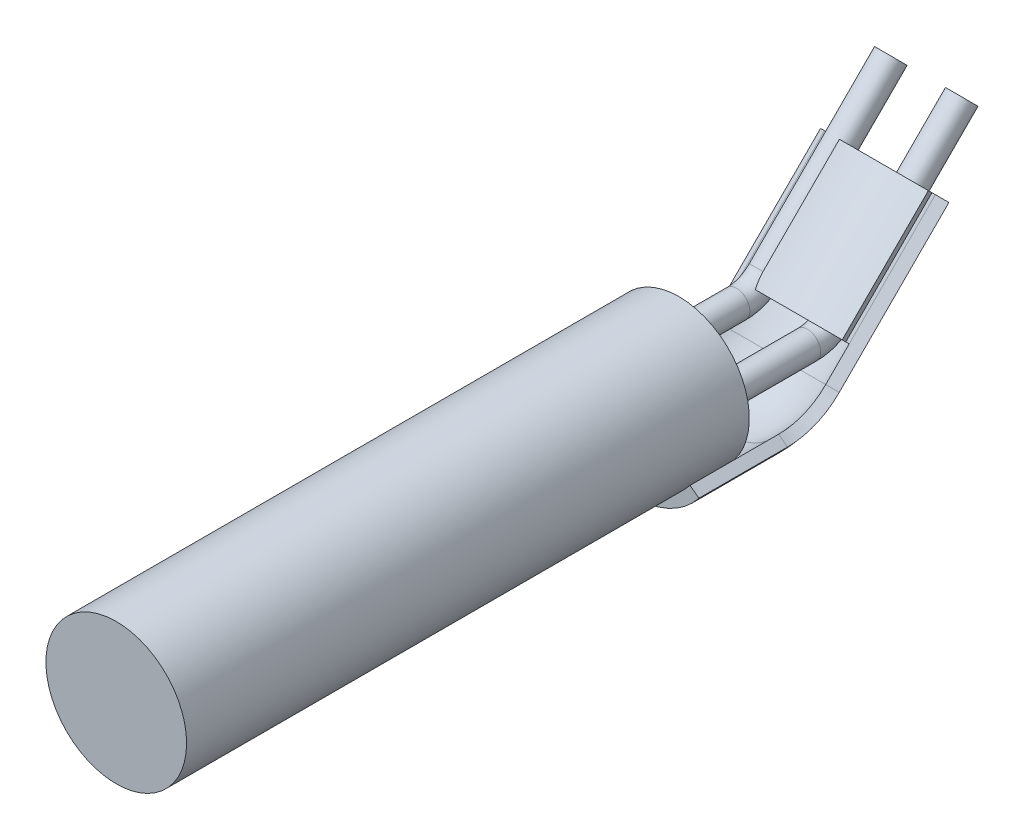
from build123d import *

# Parameters (mm, degrees)
SKETCH1_R           = 3.175
BOSS_EXTRUDE1_DEPTH = 25.4
SKETCH2_R           = 0.6
BOSS_EXTRUDE2_DEPTH = 0.5
BOSS_EXTRUDE4_DEPTH = 2
SKETCH6_R           = 0.6
BOSS_EXTRUDE5_DEPTH = 5.5


with BuildPart() as part:
    # Sketch1 → Boss-Extrude1 (new body)
    with BuildSketch(Plane.XY):
        Circle(SKETCH1_R)
    extrude(amount=BOSS_EXTRUDE1_DEPTH)

    # Sketch2 → Boss-Extrude2 (add)
    with BuildSketch(Plane(origin=(0, 0, 0), x_dir=(-1, 0, 0), z_dir=(0, 0, -1))):
        with Locations(Location((-1.6, 0, 0), (0, 0, 180))):
            Circle(SKETCH2_R)
        with Locations(Location((1.6, 0, 0), (0, 0, 180))):
            Circle(SKETCH2_R)
    extrude(amount=BOSS_EXTRUDE2_DEPTH)

    # Sketch3 → Boss-Extrude4 (add)
    with BuildSketch(Plane(origin=(0, 0, 0), x_dir=(-1, 0, 0), z_dir=(0, 0, -1))):
        with BuildLine():
            Line((-2.502919708029198, -1.9534630621434939), (-2.897080291970804, -2.2610950404338075))
            ThreePointArc((-2.897080291970804, -2.2610950404338075), (2.3e-16, -3.675), (2.897080291970804, -2.2610950404338075))
            Line((2.897080291970804, -2.2610950404338075), (2.502919708029198, -1.9534630621434939))
            ThreePointArc((2.502919708029198, -1.9534630621434939), (1.9e-16, -3.1750000000000003), (-2.502919708029198, -1.9534630621434939))
        make_face()
    extrude(amount=-BOSS_EXTRUDE4_DEPTH)

    # Sweep2: sweep along a path in Sketch4
    with BuildLine(Plane(origin=(0, 0, 0), x_dir=(0, 0, -1), z_dir=(1, 0, 0))) as sweep2_path:
        Line((0, -1.9534630621434934), (2, -1.9534630621434934))
        ThreePointArc((2, -1.9534630621434934), (3.148050297095272, -1.7251016596773525), (4.121320343559646, -1.0747834057031318))
        Line((4.121320343559646, -1.0747834057031318), (9.07106781186547, 3.874964062602709))
    # Sketch5 → Sweep2 (sweep)
    with BuildSketch(Plane(origin=(0, 0, 0), x_dir=(-1, 0, 0), z_dir=(0, 0, -1))):
        with BuildLine():
            Line((-2.897080291970804, -2.2610950404338075), (-2.502919708029198, -1.9534630621434939))
            ThreePointArc((-2.502919708029198, -1.9534630621434939), (1.9e-16, -3.1750000000000003), (2.5029197080291974, -1.9534630621434934))
            Line((2.5029197080291974, -1.9534630621434934), (2.8970802919708016, -2.2610950404338097))
            ThreePointArc((2.8970802919708016, -2.2610950404338097), (-1.41e-15, -3.675), (-2.897080291970804, -2.2610950404338075))
        make_face()
    sweep(path=sweep2_path.line)

    # Sweep3: sweep along a path in Sketch7
    with BuildLine(Plane(origin=(0, 0, 0), x_dir=(0, 0, -1), z_dir=(1, 0, 0))) as sweep3_path:
        Line((0.5, 0.6), (4.2, 0.5999999999999999))
        ThreePointArc((4.2, 0.5999999999999999), (4.678354290456363, 0.6951505843608916), (5.0838834764831855, 0.9661165235168158))
        Line((5.0838834764831855, 0.9661165235168158), (10.740737725975565, 6.622970773009196))
    # Sketch6 → Sweep3 (sweep)
    with BuildSketch(Plane(origin=(0, 0, -0.5), x_dir=(-1, 0, 0), z_dir=(0, 0, -1))):
        with Locations((-1.6, 0)):
            Circle(SKETCH6_R)
        with Locations((1.6, 0)):
            Circle(SKETCH6_R)
    sweep(path=sweep3_path.line)

    # Sketch8 → Boss-Extrude5 (add)
    with BuildSketch(Plane(origin=(0, 6.473015937234097, -6.47301593723408), x_dir=(1, 0, 0), z_dir=(0, 0.7071067811865485, -0.7071067811865467))):
        with BuildLine():
            Line((2.781137003316645, 2.8354640414089487), (2.6106804021308987, 3.3055114295648695))
            ThreePointArc((2.6106804021308987, 3.3055114295648695), (0.1288066097198567, 3.063491430701676), (-2.1639407722715798, 4.044093614911934))
            ThreePointArc((-2.1639407722715798, 4.044093614911934), (-8.516980769567e-05, 4.8957371335667155), (2.1638161204489066, 4.044209707580419))
            ThreePointArc((2.1638161204489066, 4.044209707580419), (0.35791458416402, 3.5799036404383577), (-1.2435474597789522, 4.534984686502535))
            Line((-1.2435474597789522, 4.534984686502535), (-1.645091004765738, 4.237053853120953))
            ThreePointArc((-1.645091004765738, 4.237053853120953), (0.3103286217046571, 3.0816967011024317), (2.502919708029198, 3.6742001968525564))
            Line((2.502919708029198, 3.6742001968525564), (2.897080291970804, 3.9818321751428702))
            ThreePointArc((2.897080291970804, 3.9818321751428702), (1.86e-15, 5.395737134709063), (-2.897080291970801, 3.9818321751428734))
            Line((-2.897080291970801, 3.9818321751428734), (-2.5029197080291965, 3.6742001968525577))
            ThreePointArc((-2.5029197080291965, 3.6742001968525577), (0.03084081665293148, 2.5727423400545533), (2.781137003316645, 2.8354640414089487))
        make_face()
    extrude(amount=-BOSS_EXTRUDE5_DEPTH)


solid = part.part
